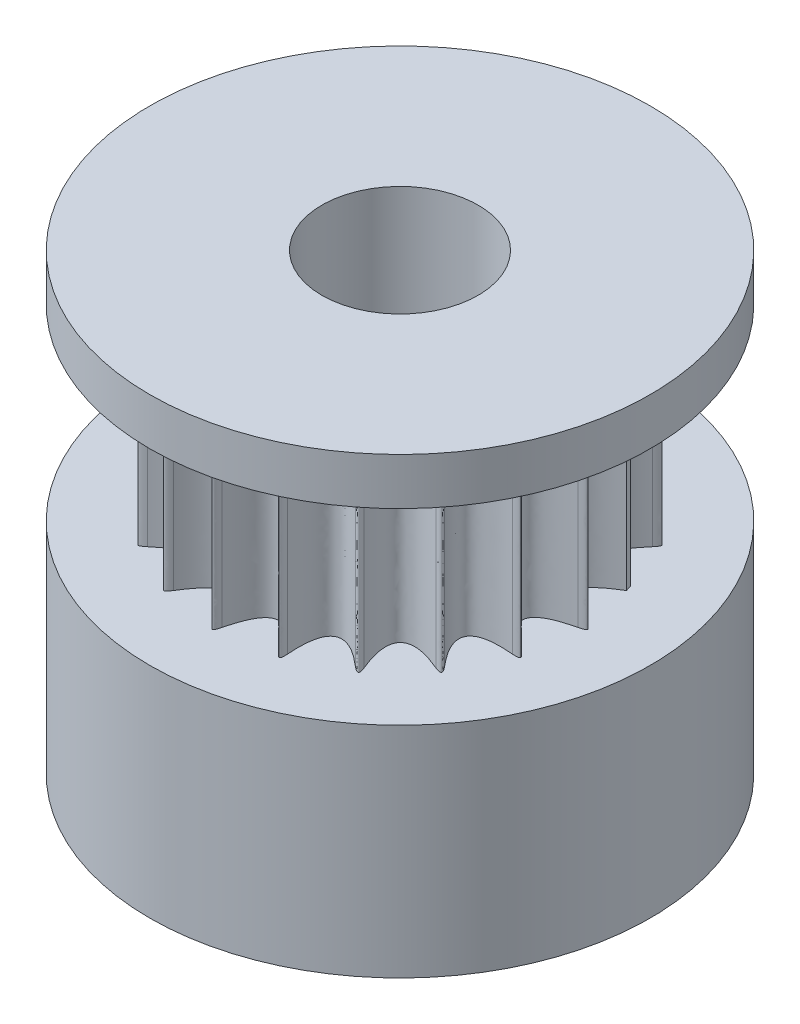
from build123d import *

# Parameters (mm, degrees)
SKETCH1_R           = 8
BOSS_EXTRUDE1_DEPTH = 7
BOSS_EXTRUDE2_DEPTH = 6
SKETCH3_R           = 8
BOSS_EXTRUDE3_DEPTH = 1.5
SKETCH4_R           = 2.5
CUT_EXTRUDE1_DEPTH  = 19.391574245


with BuildPart() as part:
    # Sketch1 → Boss-Extrude1 (new body)
    with BuildSketch(Plane(origin=(0, 0, 0), x_dir=(1, 0, 0), z_dir=(0, 1, 0))):
        with Locations(Location((0, 0, 0), (0, 0, 270))):
            Circle(SKETCH1_R)
    extrude(amount=BOSS_EXTRUDE1_DEPTH)

    # Sketch2 → Boss-Extrude2 (add)
    with BuildSketch(Plane(origin=(0, 7, 0), x_dir=(1, 0, 0), z_dir=(0, 1, 0))):
        with BuildLine():
            Line((5.547029494, 1.697192916), (5.516127795, 1.792298567))
            Line((5.516127795, 1.792298567), (5.485226095, 1.887404219))
            add(Edge.make_bspline(
                [(4.751077093, 3.328252764), (3.353389557, 1.729025513), (5.485226095, 1.887404219)],
                knots=[0, 0, 0, 1, 1, 1], degree=2))
            add(Edge.make_bspline(
                [(4.854101972, 3.526711505), (4.883491215, 3.486260648), (4.751077093, 3.328252764)],
                knots=[0.500000051, 0.500000051, 0.500000051, 1, 1, 1], degree=2))
            add(Edge.make_bspline(
                [(4.633520042, 3.490056163), (4.824712723, 3.567162371), (4.854101972, 3.526711505)],
                knots=[0, 0, 0, 0.500000051, 0.500000051, 0.500000051], degree=2))
            add(Edge.make_bspline(
                [(3.490056163, 4.633520042), (2.654964722, 2.680655343), (4.633520042, 3.490056163)],
                knots=[0, 0, 0, 1, 1, 1], degree=2))
            add(Edge.make_bspline(
                [(3.52671151, 4.854101969), (3.567162367, 4.824712713), (3.490056163, 4.633520042)],
                knots=[0.499999976, 0.499999976, 0.499999976, 1, 1, 1], degree=2))
            add(Edge.make_bspline(
                [(3.328252764, 4.751077093), (3.486260656, 4.883491222), (3.52671151, 4.854101969)],
                knots=[0, 0, 0, 0.499999976, 0.499999976, 0.499999976], degree=2))
            add(Edge.make_bspline(
                [(1.887404219, 5.485226095), (1.696653443, 3.369883951), (3.328252764, 4.751077093)],
                knots=[0, 0, 0, 1, 1, 1], degree=2))
            add(Edge.make_bspline(
                [(1.854101973, 5.706339096), (1.901654791, 5.690888234), (1.887404219, 5.485226095)],
                knots=[0.500000034, 0.500000034, 0.500000034, 1, 1, 1], degree=2))
            add(Edge.make_bspline(
                [(1.697192916, 5.547029494), (1.806549148, 5.721789959), (1.854101973, 5.706339096)],
                knots=[0, 0, 0, 0.500000034, 0.500000034, 0.500000034], degree=2))
            add(Edge.make_bspline(
                [(0.1, 5.8), (0.572261903, 3.729244838), (1.697192916, 5.547029494)],
                knots=[0, 0, 0, 1, 1, 1], degree=2))
            add(Edge.make_bspline(
                [(0, 6), (0.05, 6), (0.1, 5.8)],
                knots=[0.5, 0.5, 0.5, 1, 1, 1], degree=2))
            add(Edge.make_bspline(
                [(-0.1, 5.8), (-0.05, 6), (0, 6)],
                knots=[0, 0, 0, 0.5, 0.5, 0.5], degree=2))
            add(Edge.make_bspline(
                [(-1.697192916, 5.547029494), (-0.608146619, 3.723561257), (-0.1, 5.8)],
                knots=[0, 0, 0, 1, 1, 1], degree=2))
            add(Edge.make_bspline(
                [(-1.854101961, 5.7063391), (-1.806549134, 5.721789937), (-1.697192916, 5.547029494)],
                knots=[0.500000029, 0.500000029, 0.500000029, 1, 1, 1], degree=2))
            add(Edge.make_bspline(
                [(-1.887404219, 5.485226095), (-1.901654793, 5.69088826), (-1.854101961, 5.7063391)],
                knots=[0, 0, 0, 0.500000029, 0.500000029, 0.500000029], degree=2))
            add(Edge.make_bspline(
                [(-3.328252764, 4.751077093), (-1.729025513, 3.353389557), (-1.887404219, 5.485226095)],
                knots=[0, 0, 0, 1, 1, 1], degree=2))
            add(Edge.make_bspline(
                [(-3.526711504, 4.854101973), (-3.486260645, 4.883491213), (-3.328252764, 4.751077093)],
                knots=[0.50000006, 0.50000006, 0.50000006, 1, 1, 1], degree=2))
            add(Edge.make_bspline(
                [(-3.490056163, 4.633520042), (-3.567162373, 4.824712726), (-3.526711504, 4.854101973)],
                knots=[0, 0, 0, 0.50000006, 0.50000006, 0.50000006], degree=2))
            add(Edge.make_bspline(
                [(-4.633520042, 3.490056163), (-2.680655343, 2.654964722), (-3.490056163, 4.633520042)],
                knots=[0, 0, 0, 1, 1, 1], degree=2))
            add(Edge.make_bspline(
                [(-4.854101967, 3.526711513), (-4.824712705, 3.567162364), (-4.633520042, 3.490056163)],
                knots=[0.499999997, 0.499999997, 0.499999997, 1, 1, 1], degree=2))
            add(Edge.make_bspline(
                [(-4.751077093, 3.328252764), (-4.883491228, 3.486260663), (-4.854101967, 3.526711513)],
                knots=[0, 0, 0, 0.499999997, 0.499999997, 0.499999997], degree=2))
            add(Edge.make_bspline(
                [(-5.485226095, 1.887404219), (-3.369883951, 1.696653443), (-4.751077093, 3.328252764)],
                knots=[0, 0, 0, 1, 1, 1], degree=2))
            add(Edge.make_bspline(
                [(-5.706339094, 1.854101978), (-5.690888222, 1.90165479), (-5.485226095, 1.887404219)],
                knots=[0.500000062, 0.500000062, 0.500000062, 1, 1, 1], degree=2))
            add(Edge.make_bspline(
                [(-5.547029494, 1.697192916), (-5.721789969, 1.806549154), (-5.706339094, 1.854101978)],
                knots=[0, 0, 0, 0.500000062, 0.500000062, 0.500000062], degree=2))
            add(Edge.make_bspline(
                [(-5.8, 0.1), (-3.729244838, 0.572261903), (-5.547029494, 1.697192916)],
                knots=[0, 0, 0, 1, 1, 1], degree=2))
            add(Edge.make_bspline(
                [(-6, 0), (-6, 0.05), (-5.8, 0.1)],
                knots=[0.5, 0.5, 0.5, 1, 1, 1], degree=2))
            add(Edge.make_bspline(
                [(-5.8, -0.1), (-6, -0.05), (-6, 0)],
                knots=[0, 0, 0, 0.5, 0.5, 0.5], degree=2))
            add(Edge.make_bspline(
                [(-5.547029494, -1.697192916), (-3.723561257, -0.608146619), (-5.8, -0.1)],
                knots=[0, 0, 0, 1, 1, 1], degree=2))
            add(Edge.make_bspline(
                [(-5.706339097, -1.854101969), (-5.721789953, -1.806549144), (-5.547029494, -1.697192916)],
                knots=[0.499999986, 0.499999986, 0.499999986, 1, 1, 1], degree=2))
            add(Edge.make_bspline(
                [(-5.485226095, -1.887404219), (-5.690888242, -1.901654792), (-5.706339097, -1.854101969)],
                knots=[0, 0, 0, 0.499999986, 0.499999986, 0.499999986], degree=2))
            add(Edge.make_bspline(
                [(-4.751077093, -3.328252764), (-3.353389557, -1.729025513), (-5.485226095, -1.887404219)],
                knots=[0, 0, 0, 1, 1, 1], degree=2))
            add(Edge.make_bspline(
                [(-4.854101967, -3.526711513), (-4.883491228, -3.486260663), (-4.751077093, -3.328252764)],
                knots=[0.500000003, 0.500000003, 0.500000003, 1, 1, 1], degree=2))
            add(Edge.make_bspline(
                [(-4.633520042, -3.490056163), (-4.824712705, -3.567162364), (-4.854101967, -3.526711513)],
                knots=[0, 0, 0, 0.500000003, 0.500000003, 0.500000003], degree=2))
            add(Edge.make_bspline(
                [(-3.490056163, -4.633520042), (-2.654964722, -2.680655343), (-4.633520042, -3.490056163)],
                knots=[0, 0, 0, 1, 1, 1], degree=2))
            add(Edge.make_bspline(
                [(-3.526711519, -4.854101962), (-3.567162359, -4.824712691), (-3.490056163, -4.633520042)],
                knots=[0.500000032, 0.500000032, 0.500000032, 1, 1, 1], degree=2))
            add(Edge.make_bspline(
                [(-3.328252764, -4.751077093), (-3.486260674, -4.883491237), (-3.526711519, -4.854101962)],
                knots=[0, 0, 0, 0.500000032, 0.500000032, 0.500000032], degree=2))
            add(Edge.make_bspline(
                [(-1.887404219, -5.485226095), (-1.696653443, -3.369883951), (-3.328252764, -4.751077093)],
                knots=[0, 0, 0, 1, 1, 1], degree=2))
            add(Edge.make_bspline(
                [(-1.854101972, -5.706339096), (-1.901654791, -5.690888235), (-1.887404219, -5.485226095)],
                knots=[0.500000032, 0.500000032, 0.500000032, 1, 1, 1], degree=2))
            add(Edge.make_bspline(
                [(-1.697192916, -5.547029494), (-1.806549148, -5.721789959), (-1.854101972, -5.706339096)],
                knots=[0, 0, 0, 0.500000032, 0.500000032, 0.500000032], degree=2))
            add(Edge.make_bspline(
                [(-0.1, -5.8), (-0.572261903, -3.729244838), (-1.697192916, -5.547029494)],
                knots=[0, 0, 0, 1, 1, 1], degree=2))
            add(Edge.make_bspline(
                [(0, -6), (-0.05, -6), (-0.1, -5.8)],
                knots=[0.5, 0.5, 0.5, 1, 1, 1], degree=2))
            add(Edge.make_bspline(
                [(0.1, -5.8), (0.05, -6), (0, -6)],
                knots=[0, 0, 0, 0.5, 0.5, 0.5], degree=2))
            add(Edge.make_bspline(
                [(1.697192916, -5.547029494), (0.608146619, -3.723561257), (0.1, -5.8)],
                knots=[0, 0, 0, 1, 1, 1], degree=2))
            add(Edge.make_bspline(
                [(1.854101961, -5.7063391), (1.806549134, -5.721789937), (1.697192916, -5.547029494)],
                knots=[0.500000029, 0.500000029, 0.500000029, 1, 1, 1], degree=2))
            add(Edge.make_bspline(
                [(1.887404219, -5.485226095), (1.901654793, -5.69088826), (1.854101961, -5.7063391)],
                knots=[0, 0, 0, 0.500000029, 0.500000029, 0.500000029], degree=2))
            add(Edge.make_bspline(
                [(3.328252764, -4.751077093), (1.729025513, -3.353389557), (1.887404219, -5.485226095)],
                knots=[0, 0, 0, 1, 1, 1], degree=2))
            add(Edge.make_bspline(
                [(3.526711518, -4.854101963), (3.486260673, -4.883491236), (3.328252764, -4.751077093)],
                knots=[0.499999972, 0.499999972, 0.499999972, 1, 1, 1], degree=2))
            add(Edge.make_bspline(
                [(3.490056163, -4.633520042), (3.567162359, -4.824712693), (3.526711518, -4.854101963)],
                knots=[0, 0, 0, 0.499999972, 0.499999972, 0.499999972], degree=2))
            add(Edge.make_bspline(
                [(4.633520042, -3.490056163), (2.680655343, -2.654964722), (3.490056163, -4.633520042)],
                knots=[0, 0, 0, 1, 1, 1], degree=2))
            add(Edge.make_bspline(
                [(4.854101962, -3.526711519), (4.824712691, -3.567162358), (4.633520042, -3.490056163)],
                knots=[0.500000032, 0.500000032, 0.500000032, 1, 1, 1], degree=2))
            add(Edge.make_bspline(
                [(4.751077093, -3.328252764), (4.883491237, -3.486260674), (4.854101962, -3.526711519)],
                knots=[0, 0, 0, 0.500000032, 0.500000032, 0.500000032], degree=2))
            add(Edge.make_bspline(
                [(5.485226095, -1.887404219), (3.369883951, -1.696653443), (4.751077093, -3.328252764)],
                knots=[0, 0, 0, 1, 1, 1], degree=2))
            add(Edge.make_bspline(
                [(5.7063391, -1.854101961), (5.69088826, -1.901654793), (5.485226095, -1.887404219)],
                knots=[0.499999971, 0.499999971, 0.499999971, 1, 1, 1], degree=2))
            add(Edge.make_bspline(
                [(5.547029494, -1.697192916), (5.721789937, -1.806549134), (5.7063391, -1.854101961)],
                knots=[0, 0, 0, 0.499999971, 0.499999971, 0.499999971], degree=2))
            add(Edge.make_bspline(
                [(5.8, -0.1), (3.729244838, -0.572261903), (5.547029494, -1.697192916)],
                knots=[0, 0, 0, 1, 1, 1], degree=2))
            add(Edge.make_bspline(
                [(6, 0), (6, -0.05), (5.8, -0.1)],
                knots=[0.5, 0.5, 0.5, 1, 1, 1], degree=2))
            add(Edge.make_bspline(
                [(5.8, 0.1), (6, 0.05), (6, 0)],
                knots=[0, 0, 0, 0.5, 0.5, 0.5], degree=2))
            add(Edge.make_bspline(
                [(5.547029494, 1.697192916), (3.723561257, 0.608146619), (5.8, 0.1)],
                knots=[0, 0, 0, 1, 1, 1], degree=2))
        make_face()
    extrude(amount=BOSS_EXTRUDE2_DEPTH)

    # Sketch3 → Boss-Extrude3 (add)
    with BuildSketch(Plane(origin=(0, 13, 0), x_dir=(1, 0, 0), z_dir=(0, 1, 0))):
        with Locations(Location((0, 0, 0), (0, 0, 270))):
            Circle(SKETCH3_R)
    extrude(amount=BOSS_EXTRUDE3_DEPTH)

    # Sketch4 → Cut-Extrude1 (cut, through all)
    with BuildSketch(Plane(origin=(0, 14.5, 0), x_dir=(1, 0, 0), z_dir=(0, 1, 0))):
        with Locations(Location((0, 0, 0), (0, 0, 270))):
            Circle(SKETCH4_R)
    extrude(amount=-CUT_EXTRUDE1_DEPTH, mode=Mode.SUBTRACT)


solid = part.part
